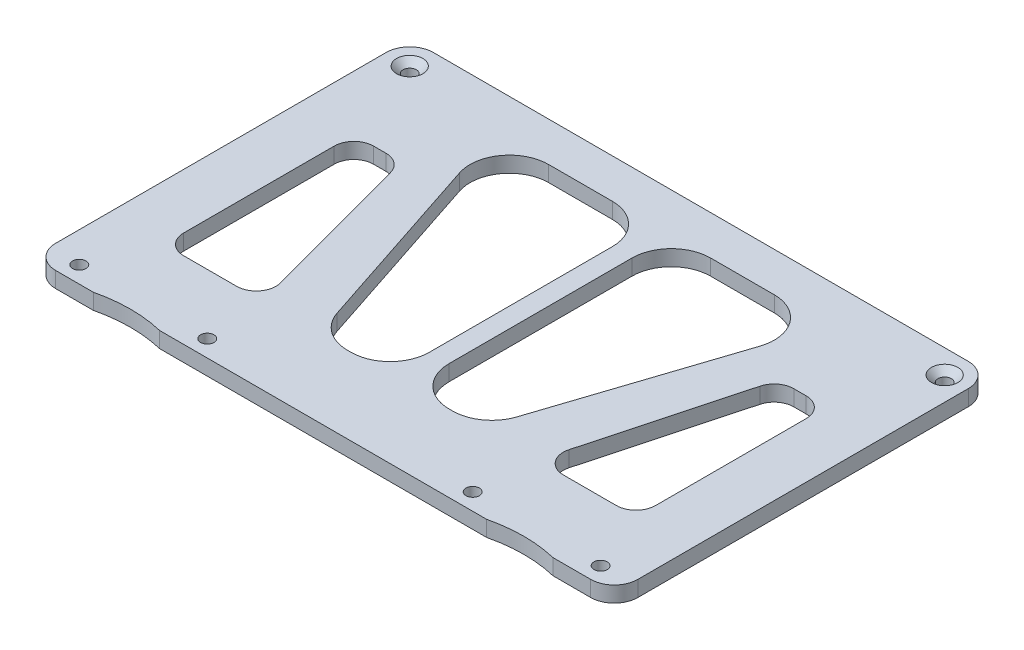
from build123d import *

# Parameters (mm, degrees)
BOSS_EXTRUDE1_DEPTH = 4
SKETCH3_R           = 1.7
CUT_EXTRUDE1_DEPTH  = 4
FILLET1_R           = 6
SKETCH4_R           = 1.7
CUT_EXTRUDE2_DEPTH  = 10
CUT_EXTRUDE3_DEPTH  = 10
CHAMFER1_SIZE       = 1.65


with BuildPart() as part:
    # Sketch2 → Boss-Extrude1 (new body)
    with BuildSketch(Plane(origin=(0, 0, 0), x_dir=(1, 0, 0), z_dir=(0, 1, 0))):
        with BuildLine():
            Line((74, 35), (74, 131))
            Line((74, 131), (-74, 131))
            Line((-74, 131), (-74, 35))
            Line((-74, 35), (-58.426149773, 35))
            ThreePointArc((-58.426149773, 35), (-50, 36), (-41.573850227, 35))
            Line((-41.573850227, 35), (41.573850227, 35))
            ThreePointArc((41.573850227, 35), (50, 36), (58.426149773, 35))
            Line((58.426149773, 35), (74, 35))
        make_face()
    extrude(amount=BOSS_EXTRUDE1_DEPTH)

    # Sketch3 → Cut-Extrude1 (cut)
    with BuildSketch(Plane(origin=(0, 4, 0), x_dir=(1, 0, 0), z_dir=(0, 1, 0))):
        with Locations((-66.264045876, -39.264880132)):
            Circle(SKETCH3_R)
        with Locations(Location((-66.264045876, 39.264880132, 0), (0, 0, 270))):
            Circle(SKETCH3_R)
        with Locations(Location((-33.735954124, 39.264880132, 0), (0, 0, 270))):
            Circle(SKETCH3_R)
        with Locations((-10.735119868, 16.264045876)):
            Circle(SKETCH3_R)
        with Locations((-10.735119868, -16.264045876)):
            Circle(SKETCH3_R)
        with Locations((-33.735954124, -39.264880132)):
            Circle(SKETCH3_R)
        with Locations((10.735119868, 16.264045876)):
            Circle(SKETCH3_R)
        with Locations(Location((33.735954124, 39.264880132, 0), (0, 0, 270))):
            Circle(SKETCH3_R)
        with Locations(Location((66.264045876, 39.264880132, 0), (0, 0, 270))):
            Circle(SKETCH3_R)
        with Locations((10.735119868, -16.264045876)):
            Circle(SKETCH3_R)
        with Locations((33.735954124, -39.264880132)):
            Circle(SKETCH3_R)
        with Locations((66.264045876, -39.264880132)):
            Circle(SKETCH3_R)
    extrude(amount=-CUT_EXTRUDE1_DEPTH, mode=Mode.SUBTRACT)

    # Fillet1
    fillet1_edges = [part.edges().sort_by_distance(p)[0] for p in [
        (-74, 2, -131),
        (74, 2, -131),
        (74, 2, -35),
        (-74, 2, -35),
    ]]
    fillet(fillet1_edges, radius=FILLET1_R)

    # Sketch4 → Cut-Extrude2 (cut)
    with BuildSketch(Plane(origin=(0, 4, 0), x_dir=(1, 0, 0), z_dir=(0, 1, 0))):
        with Locations(Location((68, 125, 0), (0, 0, 270))):
            Circle(SKETCH4_R)
        with Locations(Location((-68, 125, 0), (0, 0, 270))):
            Circle(SKETCH4_R)
    extrude(amount=-CUT_EXTRUDE2_DEPTH, mode=Mode.SUBTRACT)

    # Sketch5 → Cut-Extrude3 (cut)
    with BuildSketch(Plane(origin=(0, 4, 0), x_dir=(1, 0, 0), z_dir=(0, 1, 0))):
        with BuildLine():
            Line((-12.5, 121), (-28.674783736, 121))
            ThreePointArc((-28.674783736, 121), (-36.777367456, 116.860728372), (-38.172192195, 107.86962741))
            Line((-38.172192195, 107.86962741), (-22.851640419, 61.387768193))
            ThreePointArc((-22.851640419, 61.387768193), (-19.214960332, 56.415557063), (-13.35423196, 54.518140784))
            Line((-13.35423196, 54.518140784), (-12.5, 54.518140784))
            ThreePointArc((-12.5, 54.518140784), (-5.428932188, 57.447072972), (-2.5, 64.518140784))
            Line((-2.5, 64.518140784), (-2.5, 111))
            ThreePointArc((-2.5, 111), (-5.428932188, 118.071067812), (-12.5, 121))
        make_face()
        with BuildLine():
            Line((-60, 59.518140784), (-60, 97.798571602))
            ThreePointArc((-60, 97.798571602), (-58.535533906, 101.334105508), (-55, 102.798571602))
            Line((-55, 102.798571602), (-51.831780224, 102.798571602))
            ThreePointArc((-51.831780224, 102.798571602), (-48.790398959, 101.767198569), (-47.003737142, 99.098571602))
            Line((-47.003737142, 99.098571602), (-36.696339461, 60.818140784))
            ThreePointArc((-36.696339461, 60.818140784), (-37.555755576, 56.476759519), (-41.524382543, 54.518140784))
            Line((-41.524382543, 54.518140784), (-55, 54.518140784))
            ThreePointArc((-55, 54.518140784), (-58.535533906, 55.982606878), (-60, 59.518140784))
        make_face()
    cut_extrude3 = extrude(amount=-CUT_EXTRUDE3_DEPTH, mode=Mode.SUBTRACT)

    # Mirror1: Cut-Extrude3 across plane
    add(cut_extrude3.mirror(Plane(origin=(0, 0, 0), x_dir=(0, 0, 1), z_dir=(1, 0, 0))), mode=Mode.SUBTRACT)

    # Chamfer1
    chamfer1_edges = [part.edges().sort_by_distance(p)[0] for p in [
        (-68, 4, -126.7),
        (68, 4, -126.7),
    ]]
    chamfer(chamfer1_edges, length=CHAMFER1_SIZE)


solid = part.part
